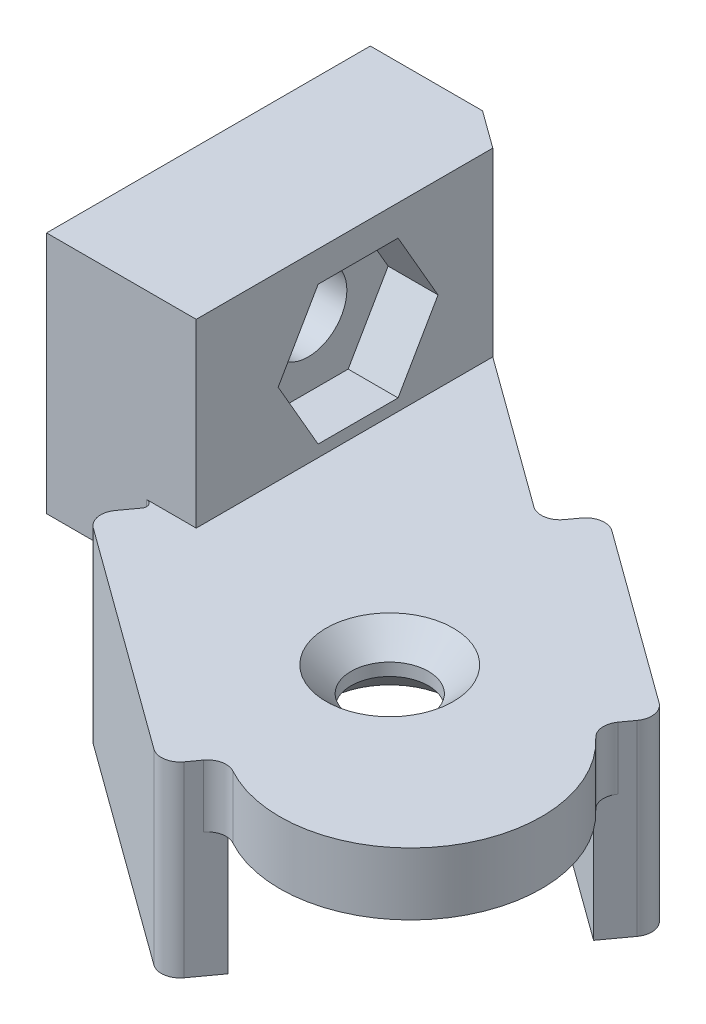
from build123d import *

# Parameters (mm, degrees)
SKETCH_1_R            = 1.55
EXTRUDE_514_DEPTH     = 2.5
EXTRUDE_START         = 2.5
EXTRUDE_981_DEPTH     = 7.5
SKETCH_3_W            = 4.5
SKETCH_3_H            = 12.978713764
EXTRUDE_1_DEPTH       = 9.75
CHAMFER_1_SIZE        = 1
FILLET_5_R            = 0.75
CUT_EXTRUDE_1_DEPTH   = 2
SKETCH_7_R            = 1.55
CUT_EXTRUDE_2_DEPTH   = 4.5
EXTRUDE_2642_DEPTH    = 7.25
CUT_EXTRUDE_1_2_DEPTH = 26.037686694
EXTRUDE_START_2       = 1.5
SKETCH_9_R            = 1.55
EXTRUDE_2_DEPTH       = 1.5
FILLET_6_R            = 0.25


with BuildPart() as part:
    # 草图1 → Extrude 514 (new body)
    with BuildSketch(Plane(origin=(0, 0, 0), x_dir=(1, 0, 0), z_dir=(0, 1, 0))):
        with BuildLine():
            Line((-10.1243866, 13.845154317), (6.15423406, 2.01804411))
            ThreePointArc((6.15423406, 2.01804411), (7.315700706, -5.315167685), (-0.017511089, -6.476634331))
            Line((-0.017511089, -6.476634331), (-10.1243866, 0.866440553))
            Line((-10.1243866, 0.866440553), (-10.1243866, 13.845154317))
        make_face()
        with Locations(Location((0, 0, 0), (0, 0, 270))):
            Circle(SKETCH_1_R, mode=Mode.SUBTRACT)
    extrude(amount=EXTRUDE_514_DEPTH)

    # 草图2 → Extrude 981 (add)
    with BuildSketch(Plane(origin=(0, 0, 0), x_dir=(1, 0, 0), z_dir=(0, 1, 0)).offset(EXTRUDE_START)):
        Polygon((-10.1243866, 0.866440553), (-0.017511089, -6.476634331), (-1.193081594, -8.09466832), (-11.299957105, -0.751593436), align=None)
        Polygon((7.329804565, 3.636078099), (-0.809505765, 9.549633202), (-1.98507627, 7.931599213), (6.15423406, 2.01804411), align=None)
    extrude(amount=-EXTRUDE_981_DEPTH)

    # 草图3 → 限位-1 (add)
    with BuildSketch(Plane(origin=(0, 0, 0), x_dir=(1, 0, 0), z_dir=(0, 1, 0))):
        with Locations((-12.3743866, 7.355797435)):
            Rectangle(SKETCH_3_W, SKETCH_3_H)
    extrude(amount=EXTRUDE_1_DEPTH)

    # 倒角1
    chamfer_1_edges = [part.edges().sort_by_distance(p)[0] for p in [
        (0, 0, -1.55),
        (0, 2.5, -1.55),
    ]]
    chamfer(chamfer_1_edges, length=CHAMFER_1_SIZE)

    # 圆角5
    fillet_5_edges = [part.edges().sort_by_distance(p)[0] for p in [
        (-1.193081594, -1.25, 8.09466832),
        (-11.299957105, -1.25, 0.751593436),
        (-1.98507627, 1.25, -7.931599213),
        (-0.809505765, -1.25, -9.549633202),
        (7.329804565, -1.25, -3.636078099),
        (-0.017511089, 1.25, 6.476634331),
        (6.15423406, 1.25, -2.01804411),
    ]]
    fillet(fillet_5_edges, radius=FILLET_5_R)

    # 草图5 → Cut-Extrude 1 (cut)
    with BuildSketch(Plane(origin=(-10.1243866, 0, 0), x_dir=(0, 0, -1), z_dir=(1, 0, 0))):
        Polygon((10.560091429, 5.75), (8.957944432, 8.525), (5.753650438, 8.525), (4.151503441, 5.75), (5.753650438, 2.975), (8.957944432, 2.975), align=None)
    extrude(amount=-CUT_EXTRUDE_1_DEPTH, mode=Mode.SUBTRACT)

    # 草图7 → 切除-拉伸2 (cut)
    with BuildSketch(Plane(origin=(-10.1243866, 0, 0), x_dir=(0, 0, -1), z_dir=(1, 0, 0))):
        with Locations((7.355797435, 5.75)):
            Circle(SKETCH_7_R)
    extrude(amount=-CUT_EXTRUDE_2_DEPTH, mode=Mode.SUBTRACT)

    # 草图8 → Extrude 2642 (add)
    with BuildSketch(Plane(origin=(0, 0, 0), x_dir=(1, 0, 0), z_dir=(0, 1, 0)).offset(EXTRUDE_START)):
        Polygon((-10.1243866, 13.845154317), (-8.6243866, 12.755340525), (-8.6243866, 0.866440553), (-10.1243866, 0.866440553), align=None)
    extrude(amount=EXTRUDE_2642_DEPTH)

    # 草图5<2> → Cut-Extrude 1 2 (cut, through all)
    with BuildSketch(Plane(origin=(-10.1243866, 0, 0), x_dir=(0, 0, -1), z_dir=(1, 0, 0))):
        Polygon((10.560091429, 5.75), (8.957944432, 8.525), (5.753650438, 8.525), (4.151503441, 5.75), (5.753650438, 2.975), (8.957944432, 2.975), align=None)
    extrude(amount=CUT_EXTRUDE_1_2_DEPTH, mode=Mode.SUBTRACT)

    # 草图9 → 结构补强螺母位-2 (add)
    with BuildSketch(Plane(origin=(-12.1243866, 0, 0), x_dir=(0, 0, -1), z_dir=(1, 0, 0)).offset(EXTRUDE_START_2)):
        Polygon((8.957944432, 2.975), (10.560091429, 5.75), (8.957944432, 8.525), (5.753650438, 8.525), (4.151503441, 5.75), (5.753650438, 2.975), align=None)
        with Locations((7.355797435, 5.75)):
            Circle(SKETCH_9_R, mode=Mode.SUBTRACT)
    extrude(amount=-EXTRUDE_2_DEPTH)

    # 圆角6
    fillet_6_edges = [part.edges().sort_by_distance(p)[0] for p in [
        (-10.1243866, 1.25, -0.866440553),
    ]]
    fillet(fillet_6_edges, radius=FILLET_6_R)


solid = part.part
